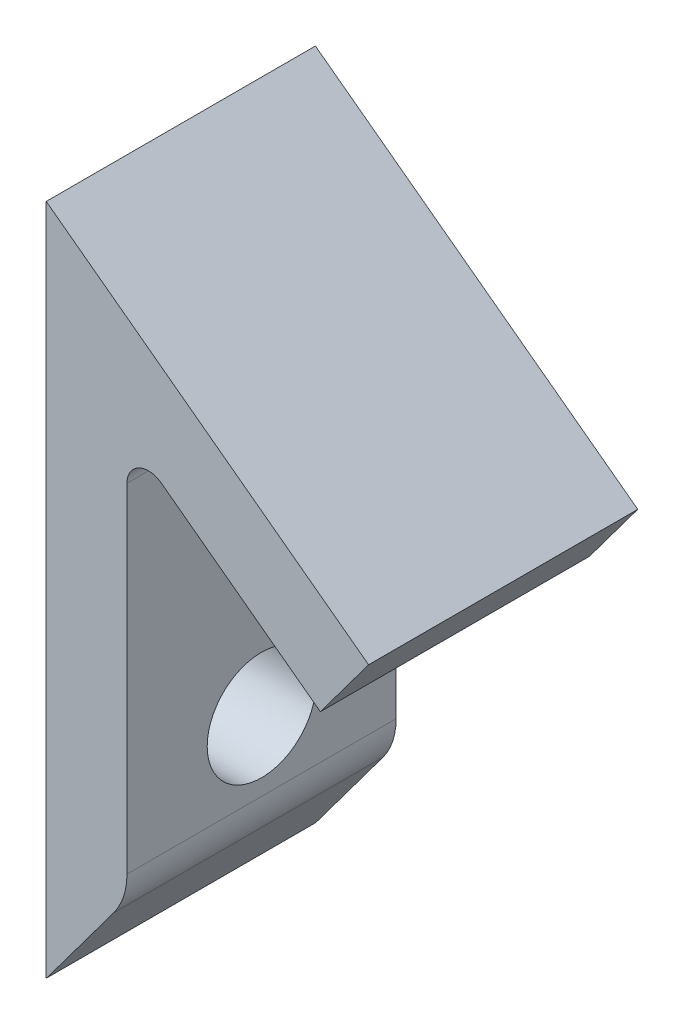
from build123d import *

# Parameters (mm, degrees)
BOSS_EXTRUDE1_DEPTH = 10
FILLET1_R           = 0.8
FILLET2_R           = 2.5
SKETCH6_R           = 2.02
CUT_EXTRUDE1_DEPTH  = 4


with BuildPart() as part:
    # Sketch2 → Boss-Extrude1 (new body)
    with BuildSketch(Plane.XY):
        Polygon((0, 21.259357975), (0, 0.022383201), (0.016670773, 0.022383201), (3, 4.02798368), (3, 19.024989439), align=None)
        Polygon((0, 22.637274757), (0, 21.259357975), (3, 19.024989439), (3, 22.765631464), (1.131871138, 24.156994247), align=None)
        Polygon((3, 22.765631464), (3, 19.024989439), (10.184363913, 13.674150545), (11.976330523, 16.080154633), align=None)
        Polygon((0, 25), (0, 22.637274757), (1.131871138, 24.156994247), align=None)
    extrude(amount=BOSS_EXTRUDE1_DEPTH)

    # Fillet1
    fillet1_edges = [part.edges().sort_by_distance(p)[0] for p in [
        (3, 19.024989439, 5),
    ]]
    fillet(fillet1_edges, radius=FILLET1_R)

    # Fillet2
    fillet2_edges = [part.edges().sort_by_distance(p)[0] for p in [
        (3, 4.02798368, 5),
    ]]
    fillet(fillet2_edges, radius=FILLET2_R)

    # Sketch6 → Cut-Extrude1 (cut)
    with BuildSketch(Plane.ZY):
        with Locations((5, 15.476622616)):
            Circle(SKETCH6_R)
        with Locations((5, 7.476622616)):
            Circle(SKETCH6_R)
    extrude(amount=-CUT_EXTRUDE1_DEPTH, mode=Mode.SUBTRACT)


solid = part.part
